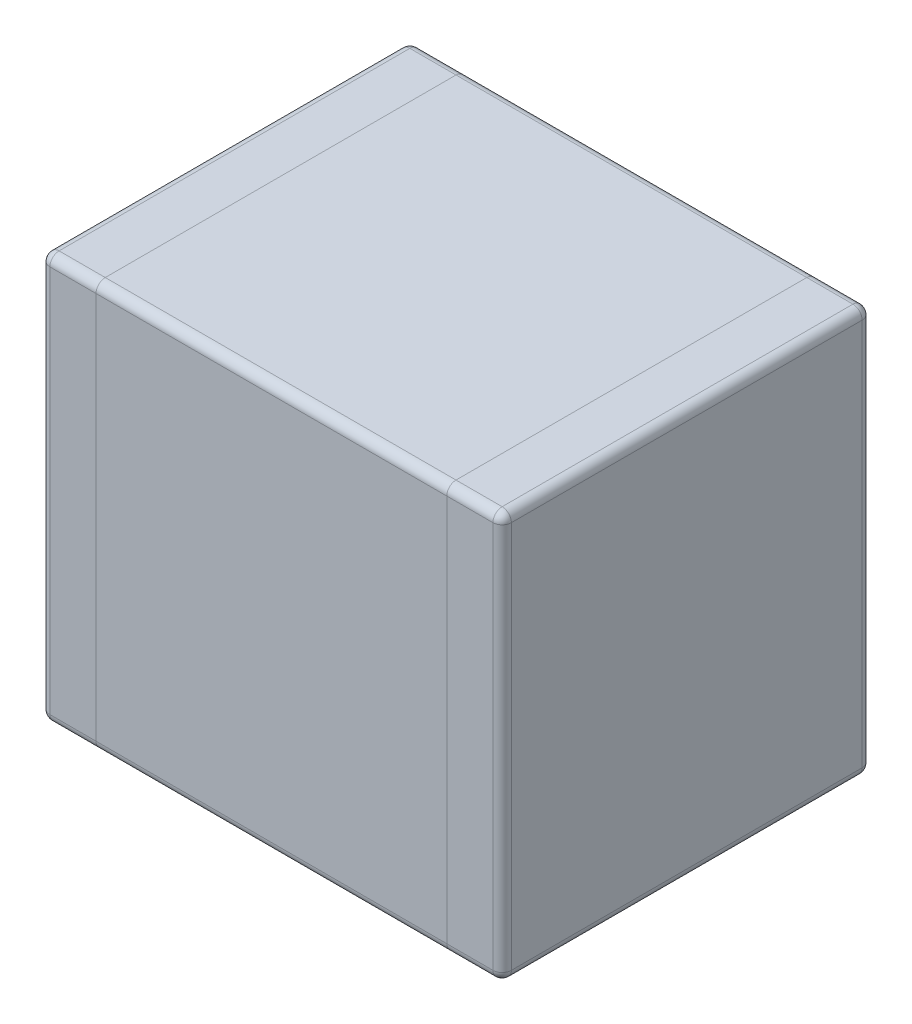
from build123d import *

# Parameters (mm, degrees)
SKETCH1_W      = 2.5
SKETCH1_H      = 2
EXTRUDE1_DEPTH = 2.2
FILLET1_R      = 0.05


with BuildPart() as part:
    # Sketch1 → Extrude1 (new body)
    with BuildSketch(Plane(origin=(0, 0, 0), x_dir=(1, 0, 0), z_dir=(0, 1, 0))):
        Rectangle(SKETCH1_W, SKETCH1_H)
    extrude(amount=EXTRUDE1_DEPTH)

    # Fillet1
    fillet1_edges = [part.edges().sort_by_distance(p)[0] for p in [
        (-1.25, 2.2, 0),
        (0, 2.2, 1),
        (1.25, 2.2, 0),
        (0, 0, 1),
        (-1.25, 0, 0),
        (0, 0, -1),
        (1.25, 0, 0),
        (0, 2.2, -1),
        (1.25, 1.1, 1),
        (-1.25, 1.1, 1),
        (-1.25, 1.1, -1),
        (1.25, 1.1, -1),
    ]]
    fillet(fillet1_edges, radius=FILLET1_R)


solid = part.part
